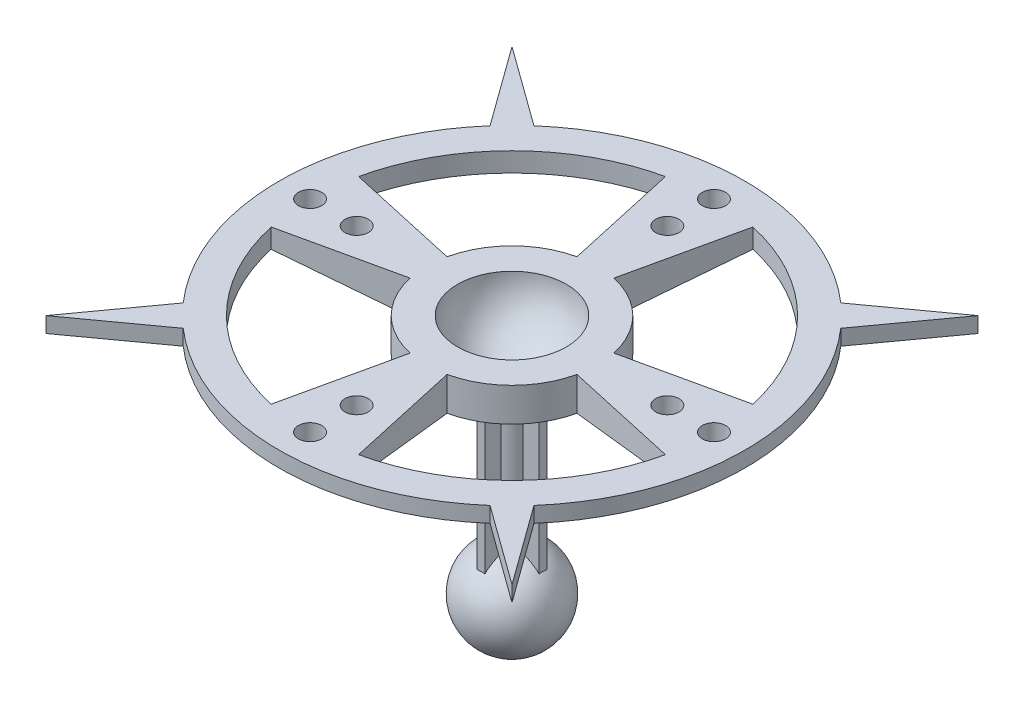
from build123d import *

# Parameters (mm, degrees)
SKETCH3_W                       = 0.5
SKETCH3_H                       = 1.75
SKETCH3_W_2                     = 1.75
SKETCH3_H_2                     = 0.5
BOSS_EXTRUDE1_DEPTH             = 13
BOSS_EXTRUDE1_DIRECTION_2_REACH = 27.695
SKETCH4_R                       = 0.75
CUT_EXTRUDE2_DEPTH              = 4
BOSS_EXTRUDE2_DEPTH             = 1


with BuildPart() as part:
    # Sketch1 → Revolve1 (revolve)
    with BuildSketch(Plane(origin=(0, 0, 0), x_dir=(0, 0, -1), z_dir=(1, 0, 0))):
        with BuildLine():
            ThreePointArc((-3.5, 4), (-2.474873734, 1.525126266), (0, 0.5))
            Line((0, 0.5), (0, 0))
            Line((0, 0), (0, -8.5))
            Line((0, -8.5), (0, -14.5))
            ThreePointArc((0, -14.5), (-2.956795679, -12.007305936), (-1, -8.671572875))
            Line((-1, -8.671572875), (-1, 0.127016654))
            ThreePointArc((-1, 0.127016654), (-2.197145125, 0.657463044), (-3.158848322, 1.546089391))
            Line((-3.158848322, 1.546089391), (-15, 3))
            Line((-15, 3), (-15, 4))
            Line((-15, 4), (-4, 4))
            Line((-4, 4), (-3.5, 4))
        make_face()
    revolve(axis=Axis((0, 10.634252877, 0), (0, 1, 0)))

    # Sketch3 → Boss-Extrude1 (add)
    with BuildSketch(Plane(origin=(0, 0, 0), x_dir=(1, 0, 0), z_dir=(0, 1, 0))):
        with Locations((0, 1.125)):
            Rectangle(SKETCH3_W, SKETCH3_H)
        with Locations((-1.125, 0)):
            Rectangle(SKETCH3_W_2, SKETCH3_H_2)
        with Locations((1.125, 0)):
            Rectangle(SKETCH3_W_2, SKETCH3_H_2)
        with Locations((0, -1.125)):
            Rectangle(SKETCH3_W, SKETCH3_H)
    extrude(amount=-BOSS_EXTRUDE1_DEPTH)

    # Sketch3 → Boss-Extrude1 direction 2 (add, up to next)
    with BuildSketch(Plane(origin=(0, 0, 0), x_dir=(1, 0, 0), z_dir=(0, 1, 0)), mode=Mode.PRIVATE) as boss_extrude1_direction_2_sk1:
        with Locations((0, 1.125)):
            Rectangle(SKETCH3_W, SKETCH3_H)
    boss_extrude1_direction_2_tool1 = extrude(boss_extrude1_direction_2_sk1.sketch, amount=BOSS_EXTRUDE1_DIRECTION_2_REACH, mode=Mode.PRIVATE) - part.part
    # Sketch3 → Boss-Extrude1 direction 2 (add, up to next)
    with BuildSketch(Plane(origin=(0, 0, 0), x_dir=(1, 0, 0), z_dir=(0, 1, 0)), mode=Mode.PRIVATE) as boss_extrude1_direction_2_sk2:
        with Locations((-1.125, 0)):
            Rectangle(SKETCH3_W_2, SKETCH3_H_2)
    boss_extrude1_direction_2_tool2 = extrude(boss_extrude1_direction_2_sk2.sketch, amount=BOSS_EXTRUDE1_DIRECTION_2_REACH, mode=Mode.PRIVATE) - part.part
    # Sketch3 → Boss-Extrude1 direction 2 (add, up to next)
    with BuildSketch(Plane(origin=(0, 0, 0), x_dir=(1, 0, 0), z_dir=(0, 1, 0)), mode=Mode.PRIVATE) as boss_extrude1_direction_2_sk3:
        with Locations((1.125, 0)):
            Rectangle(SKETCH3_W_2, SKETCH3_H_2)
    boss_extrude1_direction_2_tool3 = extrude(boss_extrude1_direction_2_sk3.sketch, amount=BOSS_EXTRUDE1_DIRECTION_2_REACH, mode=Mode.PRIVATE) - part.part
    # Sketch3 → Boss-Extrude1 direction 2 (add, up to next)
    with BuildSketch(Plane(origin=(0, 0, 0), x_dir=(1, 0, 0), z_dir=(0, 1, 0)), mode=Mode.PRIVATE) as boss_extrude1_direction_2_sk4:
        with Locations((0, -1.125)):
            Rectangle(SKETCH3_W, SKETCH3_H)
    boss_extrude1_direction_2_tool4 = extrude(boss_extrude1_direction_2_sk4.sketch, amount=BOSS_EXTRUDE1_DIRECTION_2_REACH, mode=Mode.PRIVATE) - part.part
    add(boss_extrude1_direction_2_tool1.solids().sort_by_distance((0, 0, -1.125))[0])
    add(boss_extrude1_direction_2_tool2.solids().sort_by_distance((-1.125, 0, 0))[0])
    add(boss_extrude1_direction_2_tool3.solids().sort_by_distance((1.125, 0, 0))[0])
    add(boss_extrude1_direction_2_tool4.solids().sort_by_distance((0, 0, 1.125))[0])

    # Sketch4 → Cut-Extrude2 (cut)
    with BuildSketch(Plane(origin=(0, 4, 0), x_dir=(1, 0, 0), z_dir=(0, 1, 0))):
        with BuildLine():
            Line((-1.190417877, 5.369628039), (-2.813714981, 12.691848093))
            ThreePointArc((-2.813714981, 12.691848093), (-9.192388155, 9.192388155), (-12.691848093, 2.813714981))
            Line((-12.691848093, 2.813714981), (-5.369628039, 1.190417877))
            ThreePointArc((-5.369628039, 1.190417877), (-3.889087297, 3.889087297), (-1.190417877, 5.369628039))
        make_face()
        with BuildLine():
            Line((-5.369628039, -1.190417877), (-12.691848093, -2.813714981))
            ThreePointArc((-12.691848093, -2.813714981), (-9.192388155, -9.192388155), (-2.813714981, -12.691848093))
            Line((-2.813714981, -12.691848093), (-1.190417877, -5.369628039))
            ThreePointArc((-1.190417877, -5.369628039), (-3.889087297, -3.889087297), (-5.369628039, -1.190417877))
        make_face()
        with BuildLine():
            ThreePointArc((2.813714981, -12.691848093), (9.192388155, -9.192388155), (12.691848093, -2.813714981))
            Line((12.691848093, -2.813714981), (5.369628039, -1.190417877))
            ThreePointArc((5.369628039, -1.190417877), (3.889087297, -3.889087297), (1.190417877, -5.369628039))
            Line((1.190417877, -5.369628039), (2.813714981, -12.691848093))
        make_face()
        with BuildLine():
            ThreePointArc((12.691848093, 2.813714981), (9.192388155, 9.192388155), (2.813714981, 12.691848093))
            Line((2.813714981, 12.691848093), (1.190417877, 5.369628039))
            ThreePointArc((1.190417877, 5.369628039), (3.889087297, 3.889087297), (5.369628039, 1.190417877))
            Line((5.369628039, 1.190417877), (12.691848093, 2.813714981))
        make_face()
        with Locations(Location((-13, 0, 0), (0, 0, 134.983865121))):
            Circle(SKETCH4_R)
        with Locations(Location((-10, 0, 0), (0, 0, 135.012139771))):
            Circle(SKETCH4_R)
        with Locations(Location((0, 10, 0), (0, 0, 270))):
            Circle(SKETCH4_R)
        with Locations(Location((0, 13, 0), (0, 0, 270))):
            Circle(SKETCH4_R)
        with Locations(Location((0, -10, 0), (0, 0, 135.918159621))):
            Circle(SKETCH4_R)
        with Locations(Location((0, -13, 0), (0, 0, 135.875962229))):
            Circle(SKETCH4_R)
        with Locations(Location((10, 0, 0), (0, 0, 270))):
            Circle(SKETCH4_R)
        with Locations(Location((13, 0, 0), (0, 0, 270))):
            Circle(SKETCH4_R)
    extrude(amount=-CUT_EXTRUDE2_DEPTH, mode=Mode.SUBTRACT)

    # Sketch5 → Boss-Extrude2 (add)
    with BuildSketch(Plane(origin=(0, 4, 0), x_dir=(1, 0, 0), z_dir=(0, 1, 0))):
        with BuildLine():
            ThreePointArc((-11.290112025, 9.875898463), (-10.606601718, 10.606601718), (-9.875898463, 11.290112025))
            Line((-9.875898463, 11.290112025), (-15, 15))
            Line((-15, 15), (-11.290112025, 9.875898463))
        make_face()
        with BuildLine():
            Line((15, 15), (9.875898463, 11.290112025))
            ThreePointArc((9.875898463, 11.290112025), (10.606601718, 10.606601718), (11.290112025, 9.875898463))
            Line((11.290112025, 9.875898463), (15, 15))
        make_face()
        with BuildLine():
            ThreePointArc((11.290112025, -9.875898463), (10.606601718, -10.606601718), (9.875898463, -11.290112025))
            Line((9.875898463, -11.290112025), (15, -15))
            Line((15, -15), (11.290112025, -9.875898463))
        make_face()
        with BuildLine():
            ThreePointArc((-9.875898463, -11.290112025), (-10.606601718, -10.606601718), (-11.290112025, -9.875898463))
            Line((-11.290112025, -9.875898463), (-15, -15))
            Line((-15, -15), (-9.875898463, -11.290112025))
        make_face()
    extrude(amount=-BOSS_EXTRUDE2_DEPTH)


solid = part.part
